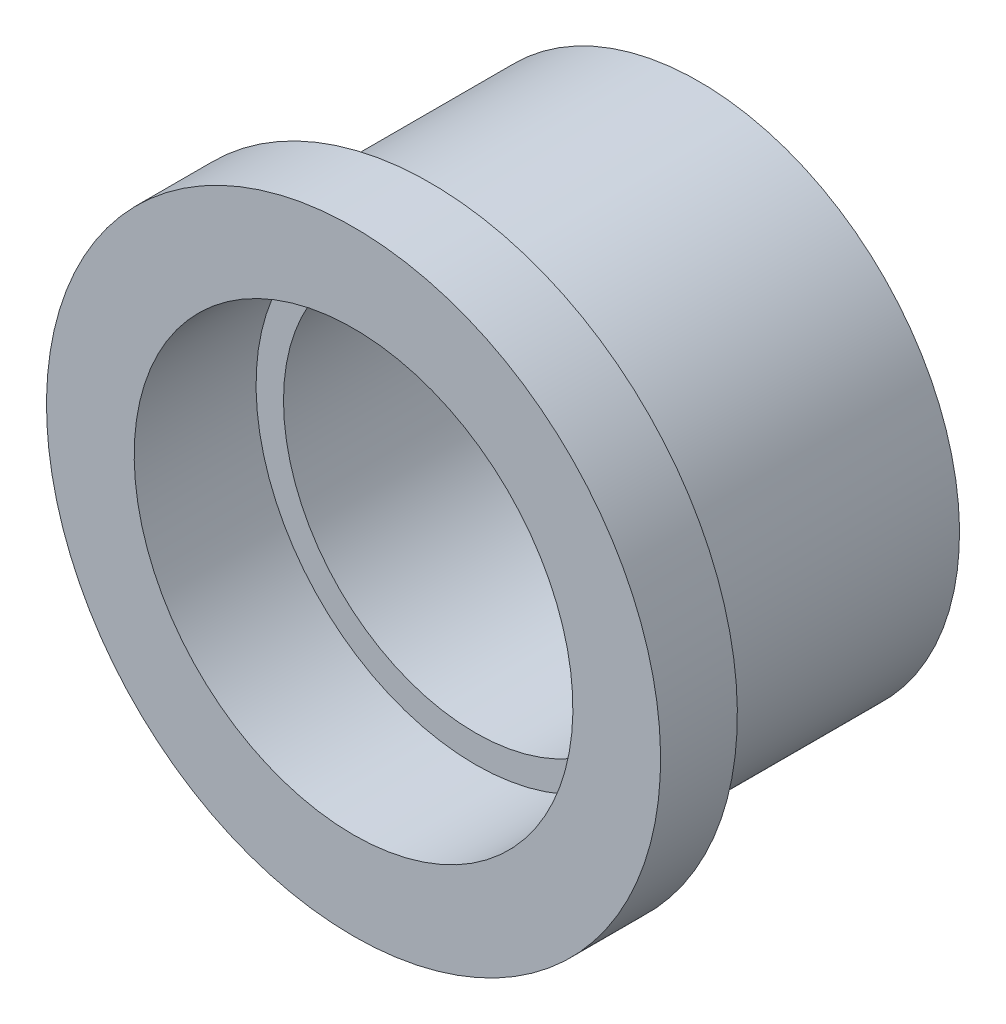
from build123d import *


with BuildPart() as part:
    # Esboço1 → Revolução1 (revolve)
    with BuildSketch(Plane(origin=(0, 0, 0), x_dir=(0, 0, -1), z_dir=(1, 0, 0)), mode=Mode.PRIVATE) as revolu_o1_sk:
        Polygon((45, 25), (45, 33.94), (10, 33.94), (10, 40), (0, 40), (0, 28.575), (15.875, 28.575), (15.875, 25), align=None)
    revolve(revolu_o1_sk.sketch.rotate(Axis((0, 0, 0), (0, 0, -1)), 180), axis=Axis((0, 0, 0), (0, 0, -1)))


solid = part.part
